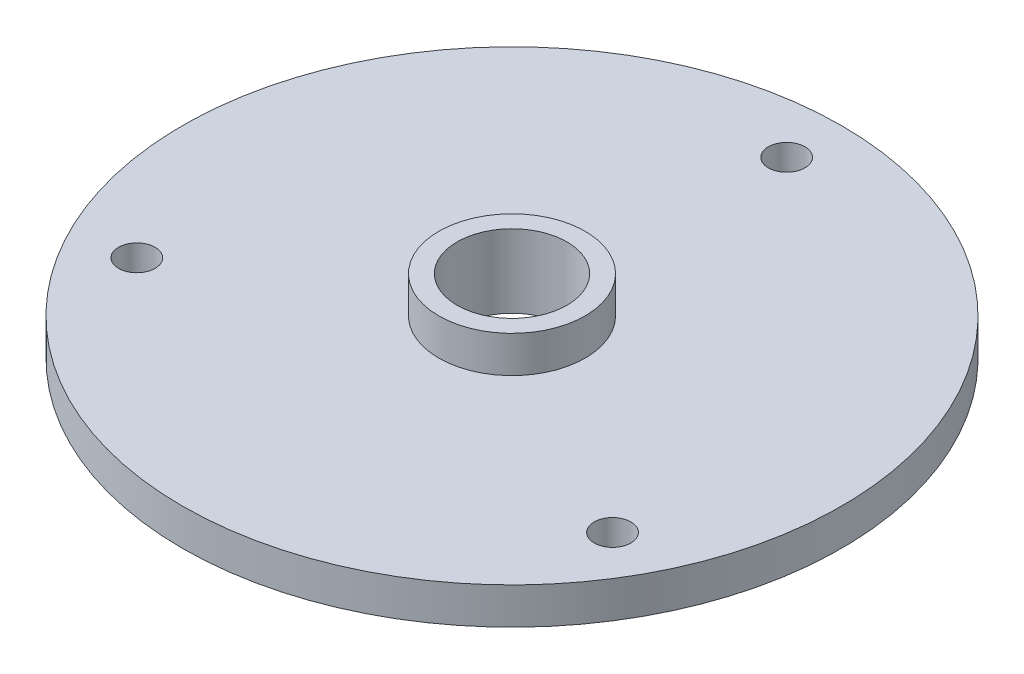
from build123d import *

# Parameters (mm, degrees)
SKETCH_1_R      = 18
SKETCH_1_R_2    = 3
SKETCH_1_R_3    = 1
EXTRUDE_1_DEPTH = 2
SKETCH_2_R      = 4
SKETCH_2_R_2    = 3
EXTRUDE_2_DEPTH = 2


with BuildPart() as part:
    # 草图1 → 凸台-拉伸1 (new body)
    with BuildSketch(Plane(origin=(0, 0, 0), x_dir=(1, 0, 0), z_dir=(0, 1, 0))):
        with Locations(Location((0, 0, 0), (0, 0, 270))):
            Circle(SKETCH_1_R)
        with Locations(Location((0, 0, 0), (0, 0, 270))):
            Circle(SKETCH_1_R_2, mode=Mode.SUBTRACT)
        with Locations(Location((0, 15, 0), (0, 0, 270))):
            Circle(SKETCH_1_R_3, mode=Mode.SUBTRACT)
        with Locations(Location((12.990381057, -7.5, 0), (0, 0, 270))):
            Circle(SKETCH_1_R_3, mode=Mode.SUBTRACT)
        with Locations(Location((-12.990381057, -7.5, 0), (0, 0, 270))):
            Circle(SKETCH_1_R_3, mode=Mode.SUBTRACT)
    extrude(amount=EXTRUDE_1_DEPTH)

    # 草图2 → 凸台-拉伸2 (add)
    with BuildSketch(Plane(origin=(0, 2, 0), x_dir=(1, 0, 0), z_dir=(0, 1, 0))):
        with Locations(Location((0, 0, 0), (0, 0, 270))):
            Circle(SKETCH_2_R)
        with Locations(Location((0, 0, 0), (0, 0, 270))):
            Circle(SKETCH_2_R_2, mode=Mode.SUBTRACT)
    extrude(amount=EXTRUDE_2_DEPTH)


solid = part.part
